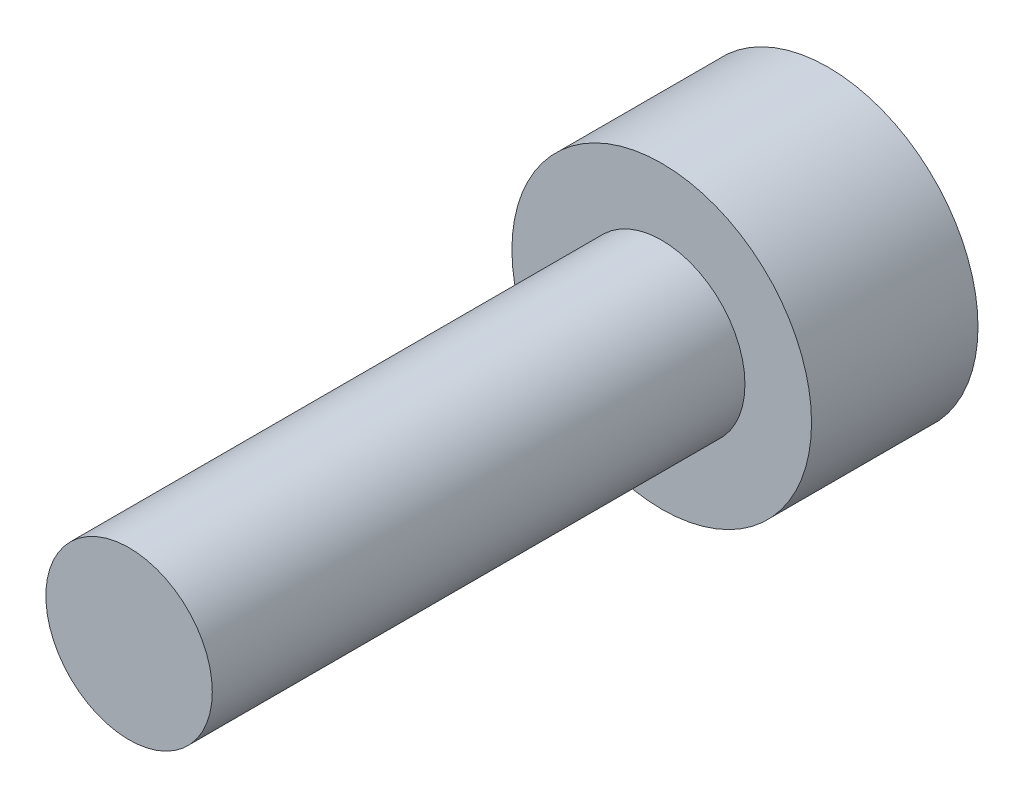
from build123d import *

# Parameters (mm, degrees)
SKETCH_1_R          = 2.25
EXTRUDE_1_DEPTH     = 2.5
SKETCH_2_R          = 1.25
EXTRUDE_2_DEPTH     = 8
CUT_EXTRUDE_1_DEPTH = 1


with BuildPart() as part:
    # 草图1 → 凸台-拉伸1 (new body)
    with BuildSketch(Plane.XY):
        Circle(SKETCH_1_R)
    extrude(amount=EXTRUDE_1_DEPTH)

    # 草图2 → 凸台-拉伸2 (add)
    with BuildSketch(Plane.XY.offset(2.5)):
        Circle(SKETCH_2_R)
    extrude(amount=EXTRUDE_2_DEPTH)

    # 草图3 → 切除-拉伸1 (cut)
    with BuildSketch(Plane(origin=(0, 0, 0), x_dir=(-1, 0, 0), z_dir=(0, 0, -1))):
        Polygon((1.154700538, 0), (0.577350269, 1), (-0.577350269, 1), (-1.154700538, 0), (-0.577350269, -1), (0.577350269, -1), align=None)
    extrude(amount=-CUT_EXTRUDE_1_DEPTH, mode=Mode.SUBTRACT)


solid = part.part
